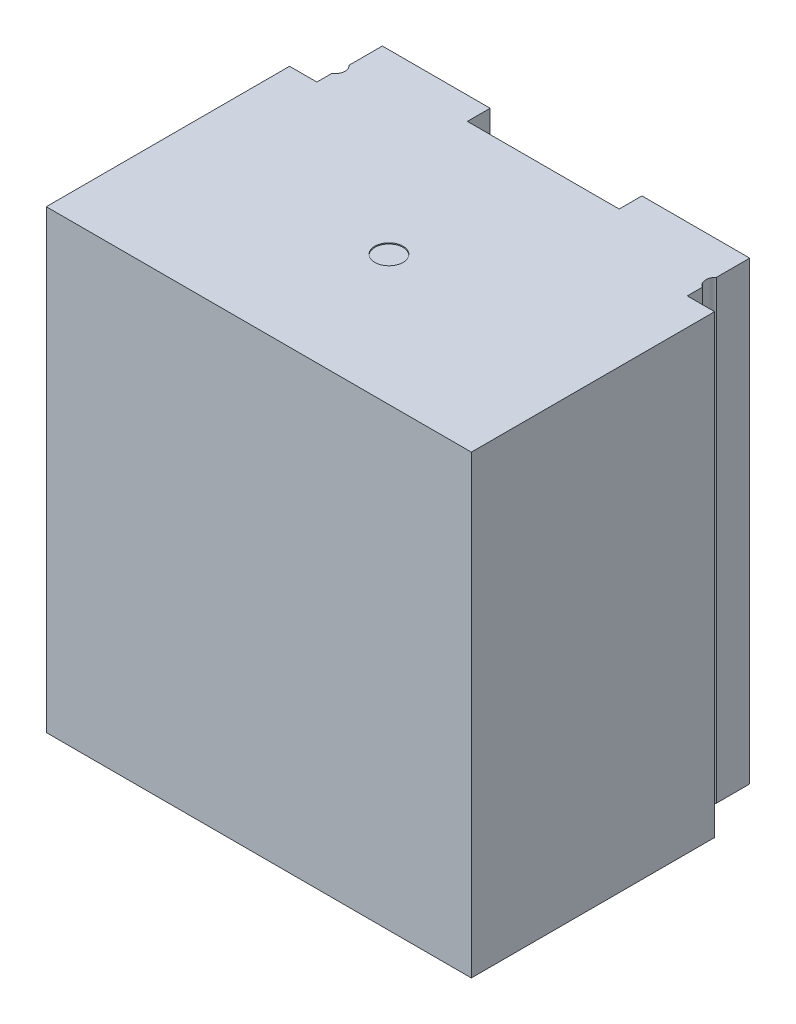
from build123d import *

# Parameters (mm, degrees)
BOSS_EXTRUDE1_DEPTH = 152.4
SCALE1_SCALE        = 0.7
SKETCH2_W           = 99.568
SKETCH2_H           = 106.68
BOSS_EXTRUDE2_DEPTH = 17.78
SKETCH3_R           = 3.302
CUT_EXTRUDE1_DEPTH  = 0.254


with BuildPart() as part:
    # Sketch1 → Boss-Extrude1 (new body)
    with BuildSketch(Plane(origin=(0, 0, 0), x_dir=(1, 0, 0), z_dir=(0, 1, 0))):
        with BuildLine():
            Line((0, 0), (0, 56))
            Line((0, 56), (9.144, 56))
            Line((9.144, 56), (9.144, 61.08))
            ThreePointArc((9.144, 61.08), (10.722825004, 63.5214881), (9.652, 66.224613392))
            Line((9.652, 66.224613392), (9.652, 77.400613392))
            Line((9.652, 77.400613392), (45.72, 77.400613392))
            Line((45.72, 77.400613392), (45.72, 69.780613392))
            Line((45.72, 69.780613392), (96.52, 69.780613392))
            Line((96.52, 69.780613392), (96.52, 77.400613392))
            Line((96.52, 77.400613392), (132.588, 77.400613392))
            Line((132.588, 77.400613392), (132.588, 66.224613392))
            ThreePointArc((132.588, 66.224613392), (131.517174996, 63.5214881), (133.096, 61.08))
            Line((133.096, 61.08), (133.096, 56))
            Line((133.096, 56), (142.24, 56))
            Line((142.24, 56), (142.24, 0))
            Line((142.24, 0), (0, 0))
        make_face()
    extrude(amount=BOSS_EXTRUDE1_DEPTH)


with BuildPart() as part_1:
    # Scale1: scaled about (71.12, 76.2, -36.236599561)
    add(part.part.scale(SCALE1_SCALE).moved(Location((21.336, 22.86, -10.870979868))))

    # Sketch2 → Boss-Extrude2 (add)
    with BuildSketch(Plane.XY.offset(-10.870979868)):
        with Locations((71.12, 76.2)):
            Rectangle(SKETCH2_W, SKETCH2_H)
    extrude(amount=BOSS_EXTRUDE2_DEPTH)

    # Sketch3 → Cut-Extrude1 (cut)
    with BuildSketch(Plane.XZ.offset(-129.54)):
        with Locations(Location((71.12, -23.570979868, 0), (0, 0, 270))):
            Circle(SKETCH3_R)
    extrude(amount=CUT_EXTRUDE1_DEPTH, mode=Mode.SUBTRACT)


solid = part_1.part
